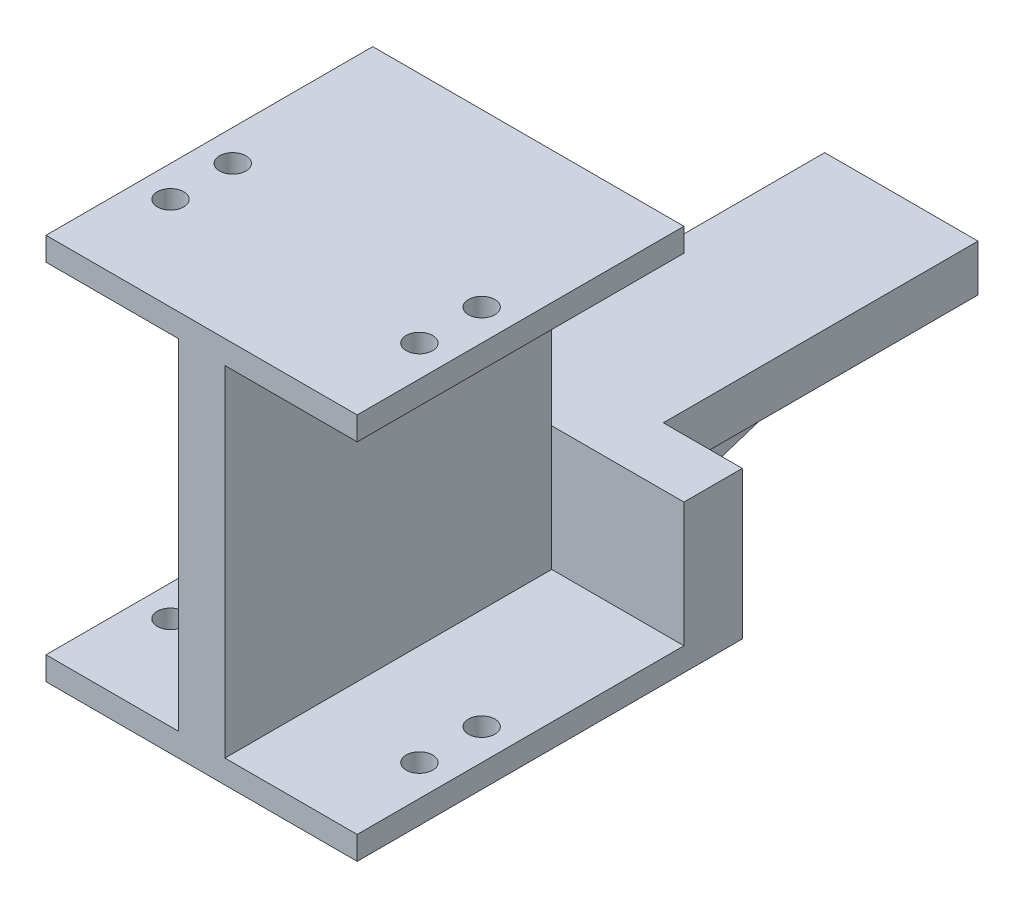
from build123d import *

# Parameters (mm, degrees)
BOSS_EXTRUDE1_DEPTH = 42
SKETCH2_W           = 40
SKETCH2_H           = 7.5
BOSS_EXTRUDE2_DEPTH = 19
SKETCH3_W           = 19.7
SKETCH3_H           = 6
BOSS_EXTRUDE3_DEPTH = 40.45
RIB1_REACH          = 59.591
SKETCH4_WALL_W      = 159.669704532
SKETCH4_WALL_H      = 6
SKETCH7_R           = 1.7
CUT_EXTRUDE1_DEPTH  = 72.897792038


with BuildPart() as part:
    # Sketch1 → Boss-Extrude1 (new body)
    with BuildSketch(Plane.XY):
        Polygon((-3, -21.85), (-3, 21.85), (-20, 21.85), (-20, 24.85), (20, 24.85), (20, 21.85), (3, 21.85), (3, -21.85), (20, -21.85), (20, -24.85), (-20, -24.85), (-20, -21.85), align=None)
    extrude(amount=BOSS_EXTRUDE1_DEPTH)

    # Sketch2 → Boss-Extrude2 (add)
    with BuildSketch(Plane(origin=(0, -24.85, 0), x_dir=(-1, 0, 0), z_dir=(0, -1, 0))):
        with Locations((0, 3.75)):
            Rectangle(SKETCH2_W, SKETCH2_H)
    extrude(amount=-BOSS_EXTRUDE2_DEPTH)

    # Sketch3 → Boss-Extrude3 (add)
    with BuildSketch(Plane(origin=(0, 0, -7.5), x_dir=(-1, 0, 0), z_dir=(0, 0, -1))):
        with Locations((0, -8.85)):
            Rectangle(SKETCH3_W, SKETCH3_H)
    extrude(amount=BOSS_EXTRUDE3_DEPTH)

    # Sketch4 wall → Rib1 (add, up to next)
    with BuildSketch(Plane(origin=(0, -18.35, -27.725), x_dir=(0, -0.305971086836, 0.952040804809), z_dir=(0, -0.952040804809, -0.305971086836)), mode=Mode.PRIVATE) as rib1_sk1:
        Rectangle(SKETCH4_WALL_W, SKETCH4_WALL_H)
    rib1_tool1 = extrude(rib1_sk1.sketch, amount=-RIB1_REACH, mode=Mode.PRIVATE) - part.part
    add(rib1_tool1.solids().sort_by_distance((0, -18.35, -27.725))[0])

    # Sketch7 → Cut-Extrude1 (cut, through all)
    with BuildSketch(Plane.XZ.offset(24.85)):
        with Locations(Location((16, 30, 0), (0, 0, 270))):
            Circle(SKETCH7_R)
        with Locations(Location((16, 22, 0), (0, 0, 270))):
            Circle(SKETCH7_R)
        with Locations(Location((-16, 22, 0), (0, 0, 270))):
            Circle(SKETCH7_R)
        with Locations(Location((-16, 30, 0), (0, 0, 270))):
            Circle(SKETCH7_R)
    extrude(amount=-CUT_EXTRUDE1_DEPTH, mode=Mode.SUBTRACT)


solid = part.part
